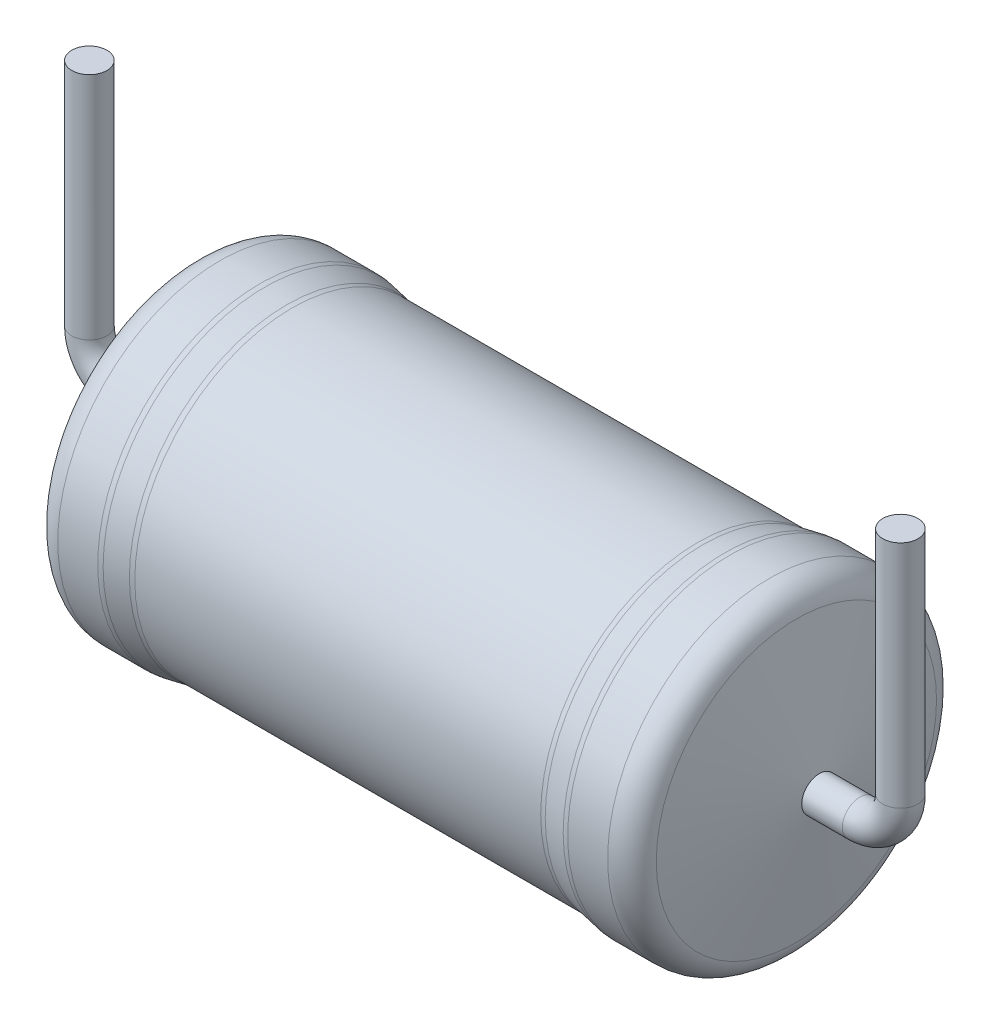
from build123d import *

# Parameters (mm, degrees)
FILLET1_R = 0.5
SKETCH4_R = 0.325


with BuildPart() as part:
    # Sketch1 → Revolve1 (revolve)
    with BuildSketch(Plane.XY, mode=Mode.PRIVATE) as revolve1_sk:
        Polygon((0, 0), (6, 0), (6, 0.325), (5.5, 3), (4.3, 3), (3.8, 2.906542056), (-3.8, 2.906542056), (-4.3, 3), (-5.5, 3), (-6, 0.325), (-6, 0), align=None)
    revolve(revolve1_sk.sketch.rotate(Axis((0, 0, 0), (1, 0, 0)), 90), axis=Axis((0, 0, 0), (1, 0, 0)))

    # Fillet1
    fillet1_edges = [part.edges().sort_by_distance(p)[0] for p in [
        (4.3, 0, -3),
        (5.5, 0, -3),
        (-5.5, 0, -3),
        (-4.3, 0, -3),
        (-3.8, 0, -2.906542056),
        (3.8, 0, -2.906542056),
    ]]
    fillet(fillet1_edges, radius=FILLET1_R)

    # Sweep1: sweep along a path in Sketch6
    with BuildLine(Plane.XY) as sweep1_path:
        Line((7.5, 5), (7.5, 0.75))
        ThreePointArc((7.5, 0.75), (7.280330086, 0.219669914), (6.75, 0))
        Line((6.75, 0), (6, 0))
        Line((6, 0), (-6.75, 0))
        ThreePointArc((-6.75, 0), (-7.280330086, 0.219669914), (-7.5, 0.75))
        Line((-7.5, 0.75), (-7.5, 5))
    # Sketch4 → Sweep1 (sweep)
    with BuildSketch(Plane(origin=(6, 0, 0), x_dir=(0, 0, -1), z_dir=(1, 0, 0))):
        Circle(SKETCH4_R)
    sweep(path=sweep1_path.line)


solid = part.part
